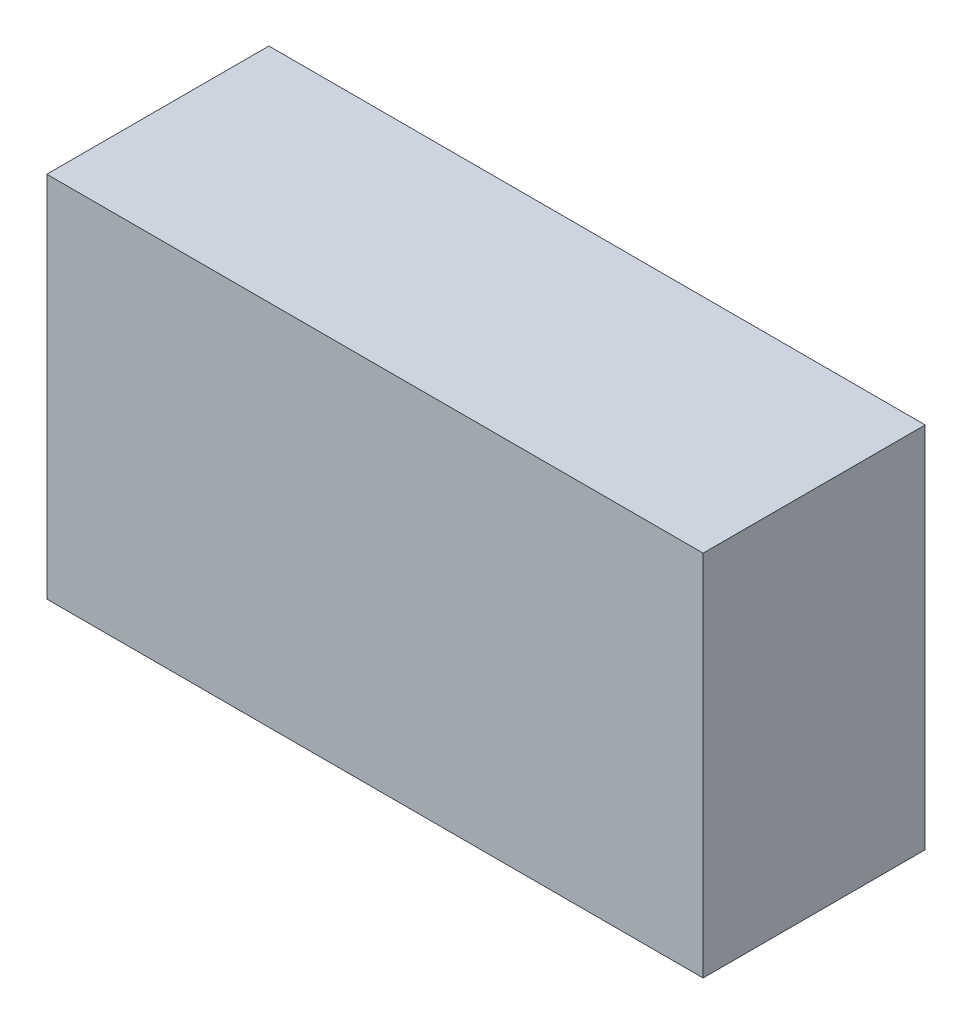
from build123d import *

# Parameters (mm, degrees)
SKETCH1_W           = 670
SKETCH1_H           = 223.333333333
BOSS_EXTRUDE1_DEPTH = 370
SHELL1_T            = -10
SKETCH5_W           = 213.333333333
SKETCH5_H           = 360
CUT_EXTRUDE1_DEPTH  = 10
SKETCH7_W           = 223.333333333
SKETCH7_H           = 370
CUT_EXTRUDE2_DEPTH  = 10


with BuildPart() as part:
    # Sketch1 → Boss-Extrude1 (new body)
    with BuildSketch(Plane(origin=(0, 0, 0), x_dir=(1, 0, 0), z_dir=(0, 1, 0))):
        with Locations((335, 111.666666667)):
            Rectangle(SKETCH1_W, SKETCH1_H)
    extrude(amount=BOSS_EXTRUDE1_DEPTH)

    # Shell1
    shell1_openings = [part.faces().sort_by_distance(p)[0] for p in [
        (0, 185, -111.666666667),
    ]]
    offset(amount=SHELL1_T, openings=shell1_openings, kind=Kind.INTERSECTION)

    # Sketch5 → Cut-Extrude1 (cut)
    with BuildSketch(Plane.ZY):
        with Locations((-111.666666667, 185)):
            Rectangle(SKETCH5_W, SKETCH5_H)
    extrude(amount=-CUT_EXTRUDE1_DEPTH, mode=Mode.SUBTRACT)

    # Sketch7 → Cut-Extrude2 (cut)
    with BuildSketch(Plane.ZY):
        with Locations((-111.666666667, 185)):
            Rectangle(SKETCH7_W, SKETCH7_H)
    extrude(amount=-CUT_EXTRUDE2_DEPTH, mode=Mode.SUBTRACT)


solid = part.part
